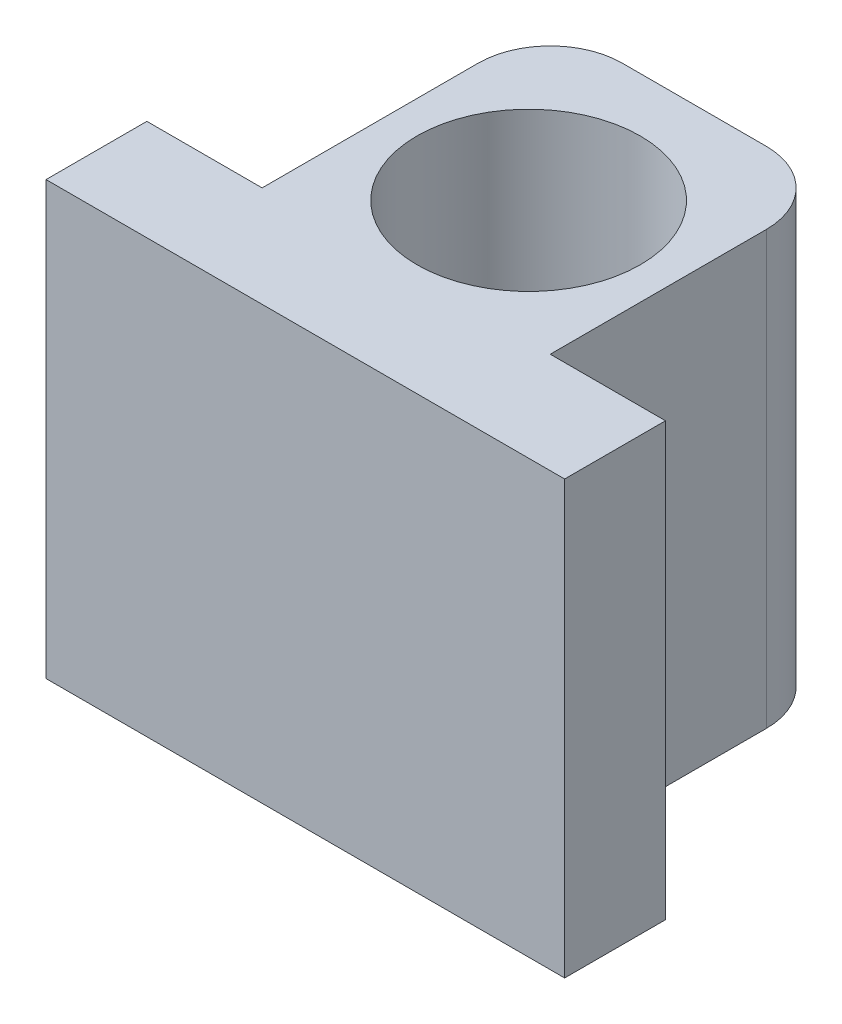
from build123d import *

# Parameters (mm, degrees)
BOSS_EXTRUDE1_DEPTH = 30
SKETCH3_R           = 7.75
CUT_EXTRUDE1_DEPTH  = 30
FILLET1_R           = 5
SKETCH4_W           = 36
SKETCH4_H           = 30
BOSS_EXTRUDE2_DEPTH = 4


with BuildPart() as part:
    # Sketch2 → Boss-Extrude1 (new body)
    with BuildSketch(Plane(origin=(0, 0, 0), x_dir=(1, 0, 0), z_dir=(0, 1, 0))):
        Polygon((-14.863905325, 0), (-6.863905325, 0), (-6.863905325, 20), (13.136094675, 20), (13.136094675, 0), (21.136094675, 0), (21.136094675, -3), (-14.863905325, -3), align=None)
    extrude(amount=BOSS_EXTRUDE1_DEPTH)

    # Sketch3 → Cut-Extrude1 (cut)
    with BuildSketch(Plane.XZ):
        with Locations(Location((3.136094675, -8.5, 0), (0, 0, 270))):
            Circle(SKETCH3_R)
    extrude(amount=-CUT_EXTRUDE1_DEPTH, mode=Mode.SUBTRACT)

    # Fillet1
    fillet1_edges = [part.edges().sort_by_distance(p)[0] for p in [
        (-6.863905325, 15, -20),
        (13.136094675, 15, -20),
    ]]
    fillet(fillet1_edges, radius=FILLET1_R)

    # Sketch4 → Boss-Extrude2 (add)
    with BuildSketch(Plane.XY.offset(3)):
        with Locations((3.136094675, 15)):
            Rectangle(SKETCH4_W, SKETCH4_H)
    extrude(amount=BOSS_EXTRUDE2_DEPTH)


solid = part.part
